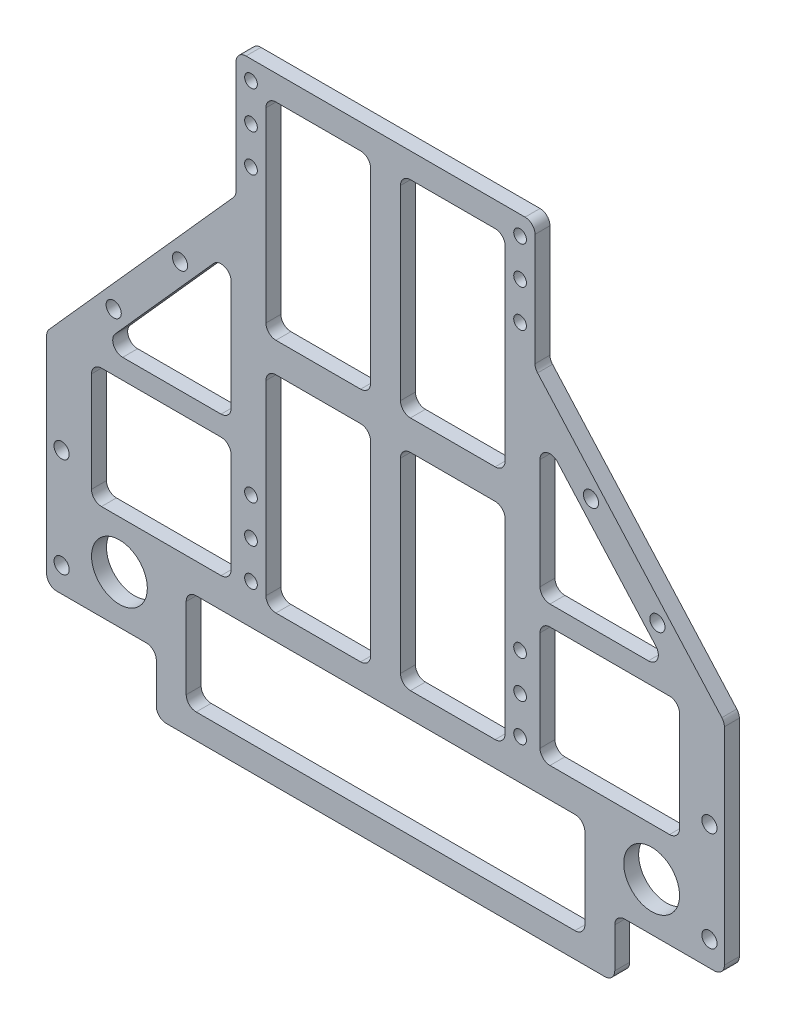
from build123d import *

# Parameters (mm, degrees)
SKETCH_1_W             = 60
SKETCH_1_H             = 124
EXTRUDE_1_DEPTH        = 3
EXTRUDE_2_DEPTH        = 3
SKETCH_3_W             = 136
SKETCH_3_H             = 57.699964
EXTRUDE_3_DEPTH        = 3
CUT_EXTRUDE_1_DEPTH    = 3
SKETCH_5_W             = 22
SKETCH_5_H             = 12
CUT_EXTRUDE_2_DEPTH    = 10
SKETCH_6_R             = 1.275
CUT_EXTRUDE_3_DEPTH    = 10
PATTERN_LINEAR_1_COUNT = 2
PATTERN_LINEAR_1_PITCH = 7.5
PATTERN_LINEAR_2_COUNT = 2
PATTERN_LINEAR_2_PITCH = 7.5
SKETCH_7_R             = 1.525
CUT_EXTRUDE_4_DEPTH    = 10
FILLET_1_R             = 2
SKETCH_8_W             = 21
SKETCH_8_H             = 41.4
CUT_EXTRUDE_5_DEPTH    = 22
FILLET_2_R             = 2
SKETCH_10_W            = 80
SKETCH_10_H            = 20.2
CUT_EXTRUDE_6_DEPTH    = 3
FILLET_3_R             = 2
CUT_EXTRUDE_7_DEPTH    = 3
EXTRUDE_5_DEPTH        = 3
CUT_EXTRUDE_START      = -22
SKETCH_13_R            = 5.6
CUT_EXTRUDE_8_DEPTH    = 115.070625066
FILLET_4_R             = 2


with BuildPart() as part:
    # 草图1 → 凸台-拉伸1 (new body)
    with BuildSketch(Plane.XY):
        Rectangle(SKETCH_1_W, SKETCH_1_H)
    extrude(amount=EXTRUDE_1_DEPTH)

    # 草图2 → 凸台-拉伸2 (add)
    with BuildSketch(Plane(origin=(0, 0, 0), x_dir=(-1, 0, 0), z_dir=(0, 0, -1))):
        Polygon((-66.648513504, -4.300036), (66.648513504, -4.300036), (30, 36.746299124), (-30, 36.746299124), align=None)
    extrude(amount=-EXTRUDE_2_DEPTH)

    # 草图3 → 凸台-拉伸3 (add)
    with BuildSketch(Plane.XY.offset(3)):
        with Locations((0, -33.150018)):
            Rectangle(SKETCH_3_W, SKETCH_3_H)
    extrude(amount=-EXTRUDE_3_DEPTH)

    # 草图4 → 切除-拉伸1 (cut)
    with BuildSketch(Plane.XY.offset(3)):
        Polygon((68, -4.300036), (68, -5.813700876), (66.648513504, -4.300036), align=None)
        Polygon((-66.648513504, -4.300036), (-68, -4.300036), (-68, -5.813700876), align=None)
    extrude(amount=-CUT_EXTRUDE_1_DEPTH, mode=Mode.SUBTRACT)

    # 草图5 → 切除-拉伸2 (cut)
    with BuildSketch(Plane(origin=(0, 0, 0), x_dir=(-1, 0, 0), z_dir=(0, 0, -1))):
        with Locations((-57, -56)):
            Rectangle(SKETCH_5_W, SKETCH_5_H)
    cut_extrude_2 = extrude(amount=-CUT_EXTRUDE_2_DEPTH, mode=Mode.SUBTRACT)

    # 镜向1: 切除-拉伸2 across plane
    add(cut_extrude_2.mirror(Plane(origin=(0, 0, 0), x_dir=(0, 0, 1), z_dir=(1, 0, 0))), mode=Mode.SUBTRACT)

    # 草图6 → 切除-拉伸3 (cut)
    with BuildSketch(Plane(origin=(0, 0, 0), x_dir=(-1, 0, 0), z_dir=(0, 0, -1))):
        with Locations((-27, 50.7)):
            Circle(SKETCH_6_R)
        with Locations((27, 50.7)):
            Circle(SKETCH_6_R)
        with Locations((27, -21.3)):
            Circle(SKETCH_6_R)
        with Locations((-27, -21.3)):
            Circle(SKETCH_6_R)
    cut_extrude_3 = extrude(amount=-CUT_EXTRUDE_3_DEPTH, mode=Mode.SUBTRACT)

    # 阵列(线性)1: 切除-拉伸3 ×2
    with Locations(*[(0, i * PATTERN_LINEAR_1_PITCH, 0) for i in range(1, PATTERN_LINEAR_1_COUNT)]):
        add(cut_extrude_3, mode=Mode.SUBTRACT)

    # 阵列(线性)2: 切除-拉伸3 ×2
    with Locations(*[(0, -i * PATTERN_LINEAR_2_PITCH, 0) for i in range(1, PATTERN_LINEAR_2_COUNT)]):
        add(cut_extrude_3, mode=Mode.SUBTRACT)

    # 草图7 → 切除-拉伸4 (cut)
    with BuildSketch(Plane(origin=(0, 0, 0), x_dir=(-1, 0, 0), z_dir=(0, 0, -1))):
        with Locations((65, -45)):
            Circle(SKETCH_7_R)
        with Locations((65, -25)):
            Circle(SKETCH_7_R)
        with Locations((41.234077164, 19.659734849)):
            Circle(SKETCH_7_R)
        with Locations((54.554392551, 4.740981616)):
            Circle(SKETCH_7_R)
    cut_extrude_4 = extrude(amount=-CUT_EXTRUDE_4_DEPTH, mode=Mode.SUBTRACT)

    # 镜向2: 切除-拉伸4 across plane
    add(cut_extrude_4.mirror(Plane(origin=(0, 0, 0), x_dir=(0, 0, 1), z_dir=(1, 0, 0))), mode=Mode.SUBTRACT)

    # 圆角1
    fillet_1_edges = [part.edges().sort_by_distance(p)[0] for p in [
        (-68, -50, 1.5),
        (-46, -62, 1.5),
        (-46, -50, 1.5),
        (-30, 36.746299124, 1.5),
        (30, 36.746299124, 1.5),
        (68, -5.813700876, 1.5),
        (-68, -5.813700876, 1.5),
        (-30, 62, 1.5),
        (30, 62, 1.5),
        (68, -50, 1.5),
        (46, -50, 1.5),
        (46, -62, 1.5),
    ]]
    fillet(fillet_1_edges, radius=FILLET_1_R)

    # 草图8 → 切除-拉伸5 (cut)
    with BuildSketch(Plane(origin=(0, 0, 0), x_dir=(-1, 0, 0), z_dir=(0, 0, -1))):
        with Locations((-13.5, -11.1)):
            Rectangle(SKETCH_8_W, SKETCH_8_H)
        with Locations((13.5, -11.1)):
            Rectangle(SKETCH_8_W, SKETCH_8_H)
        with Locations((13.5, 36.3)):
            Rectangle(SKETCH_8_W, SKETCH_8_H)
        with Locations((-13.5, 36.3)):
            Rectangle(SKETCH_8_W, SKETCH_8_H)
    extrude(amount=-CUT_EXTRUDE_5_DEPTH, mode=Mode.SUBTRACT)

    # 圆角2
    fillet_2_edges = [part.edges().sort_by_distance(p)[0] for p in [
        (24, 15.6, 1.5),
        (24, 57, 1.5),
        (3, 57, 1.5),
        (3, 15.6, 1.5),
        (-3, 57, 1.5),
        (-24, 57, 1.5),
        (-24, 15.6, 1.5),
        (-3, 15.6, 1.5),
        (-3, 9.6, 1.5),
        (-24, 9.6, 1.5),
        (-24, -31.8, 1.5),
        (-3, -31.8, 1.5),
        (3, 9.6, 1.5),
        (3, -31.8, 1.5),
        (24, -31.8, 1.5),
        (24, 9.6, 1.5),
    ]]
    fillet(fillet_2_edges, radius=FILLET_2_R)

    # 草图10 → 切除-拉伸6 (cut)
    with BuildSketch(Plane(origin=(0, 0, 0), x_dir=(-1, 0, 0), z_dir=(0, 0, -1))):
        with Locations((0, -46.9)):
            Rectangle(SKETCH_10_W, SKETCH_10_H)
    extrude(amount=-CUT_EXTRUDE_6_DEPTH, mode=Mode.SUBTRACT)

    # 圆角3
    fillet_3_edges = [part.edges().sort_by_distance(p)[0] for p in [
        (-40, -36.8, 1.5),
        (-40, -57, 1.5),
        (40, -57, 1.5),
        (40, -36.8, 1.5),
    ]]
    fillet(fillet_3_edges, radius=FILLET_3_R)

    # 草图11 → 切除-拉伸7 (cut)
    with BuildSketch(Plane.XY.offset(3)):
        Polygon((-31, 26.617503422), (-59, -4.742496578), (-59, -30.8), (-31, -30.8), align=None)
    cut_extrude_7 = extrude(amount=-CUT_EXTRUDE_7_DEPTH, mode=Mode.SUBTRACT)

    # 镜向3: 切除-拉伸7 across plane
    add(cut_extrude_7.mirror(Plane(origin=(0, 0, 0), x_dir=(0, 0, 1), z_dir=(1, 0, 0))), mode=Mode.SUBTRACT)

    # 草图12 → 凸台-拉伸5 (add)
    with BuildSketch(Plane(origin=(0, 0, 0), x_dir=(-1, 0, 0), z_dir=(0, 0, -1))):
        with BuildLine():
            Line((-59, -6.742496578), (-31, -6.742496578))
            ThreePointArc((-31, -6.742496578), (-29, -4.742496578), (-31, -2.742496578))
            Line((-31, -2.742496578), (-59, -2.742496578))
            ThreePointArc((-59, -2.742496578), (-61, -4.742496578), (-59, -6.742496578))
        make_face()
    extrude_5 = extrude(amount=-EXTRUDE_5_DEPTH)

    # 镜向4: 凸台-拉伸5 across plane
    add(extrude_5.mirror(Plane(origin=(0, 0, 0), x_dir=(0, 0, 1), z_dir=(1, 0, 0))))

    # 草图13 → 切除-拉伸8 (cut)
    with BuildSketch(Plane(origin=(0, 0, 0), x_dir=(-1, 0, 0), z_dir=(0, 0, -1)).offset(CUT_EXTRUDE_START)):
        with Locations(Location((53.4, -40.4, 0), (0, 0, 180))):
            Circle(SKETCH_13_R)
    cut_extrude_8 = extrude(amount=CUT_EXTRUDE_8_DEPTH, mode=Mode.SUBTRACT)

    # 镜向5: 切除-拉伸8 across plane
    add(cut_extrude_8.mirror(Plane(origin=(0, 0, 0), x_dir=(0, 0, 1), z_dir=(1, 0, 0))), mode=Mode.SUBTRACT)

    # 圆角4
    fillet_4_edges = [part.edges().sort_by_distance(p)[0] for p in [
        (-59, -30.8, 1.5),
        (-31, -30.8, 1.5),
        (-31, 26.617503422, 1.5),
        (31, -30.8, 1.5),
        (31, 26.617503422, 1.5),
        (59, -30.8, 1.5),
        (57.214285714, -2.742496578, 1.5),
        (59, -6.742496578, 1.5),
        (31, -2.742496578, 1.5),
        (31, -6.742496578, 1.5),
        (-57.214285714, -2.742496578, 1.5),
        (-31, -2.742496578, 1.5),
        (-31, -6.742496578, 1.5),
        (-59, -6.742496578, 1.5),
    ]]
    fillet(fillet_4_edges, radius=FILLET_4_R)


solid = part.part
